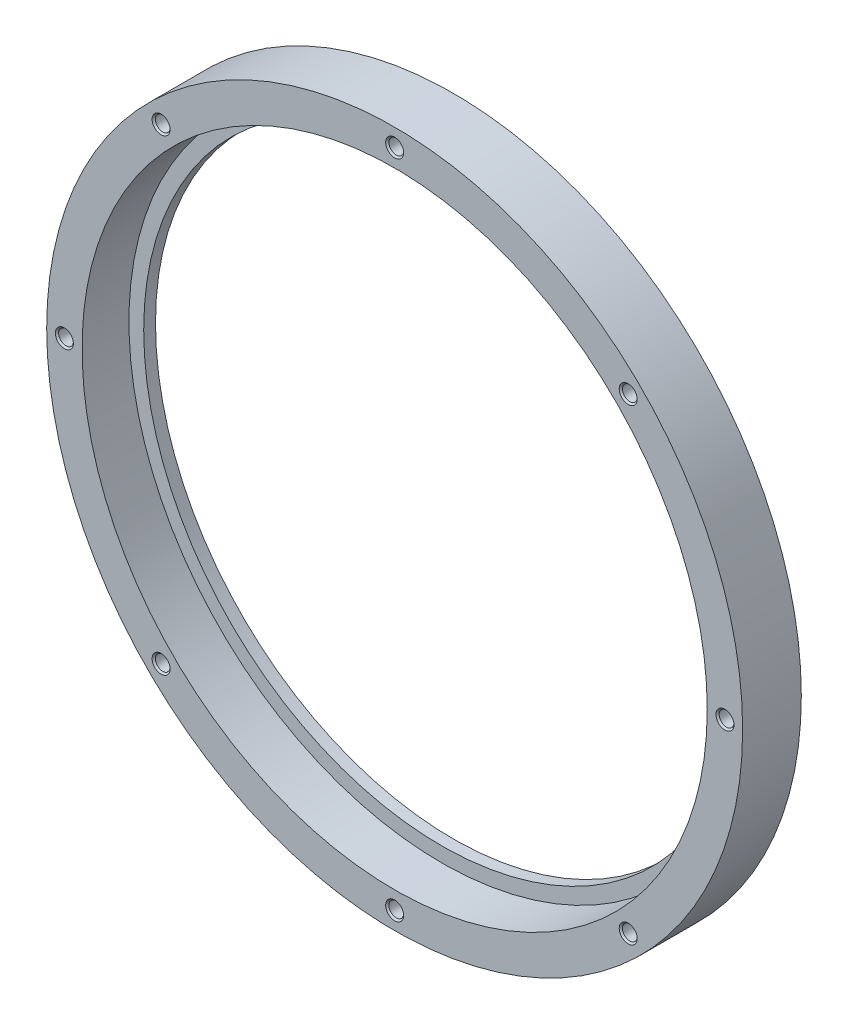
from build123d import *

# Parameters (mm, degrees)
SKETCH_1_R                   = 59
SKETCH_1_R_2                 = 53
EXTRUDE_1_DEPTH              = 3.975
SKETCH_2_R                   = 59
SKETCH_2_R_2                 = 50.5
EXTRUDE_2_DEPTH              = 2
HOLE_WIZARD_M3_1_D           = 2.5
HOLE_WIZARD_M3_1_CSINK_D     = 3.05
HOLE_WIZARD_M3_1_CSINK_ANGLE = 90
PATTERN_CIRCULAR_1_COUNT     = 8


with BuildPart() as part:
    # 草图1 → 凸台-拉伸1 (new, symmetric)
    with BuildSketch(Plane.XY):
        Circle(SKETCH_1_R)
        Circle(SKETCH_1_R_2, mode=Mode.SUBTRACT)
    extrude(amount=EXTRUDE_1_DEPTH, both=True)

    # 草图2 → 凸台-拉伸2 (add)
    with BuildSketch(Plane(origin=(0, 0, -3.975), x_dir=(-1, 0, 0), z_dir=(0, 0, -1))):
        Circle(SKETCH_2_R)
        Circle(SKETCH_2_R_2, mode=Mode.SUBTRACT)
    extrude(amount=EXTRUDE_2_DEPTH)

    # M3 螺纹孔1 (through all)
    with Locations(Plane.XY.offset(3.975)):
        with Locations((0, 56)):
            hole_wizard_m3_1 = CounterSinkHole(HOLE_WIZARD_M3_1_D / 2, HOLE_WIZARD_M3_1_CSINK_D / 2, counter_sink_angle=HOLE_WIZARD_M3_1_CSINK_ANGLE)

    # 阵列(圆周)1: M3 螺纹孔1 ×8 about axis
    pattern_circular_1_axis = Axis((0, 0, 0), (0, 0, 1))
    for i in range(1, PATTERN_CIRCULAR_1_COUNT):
        add(hole_wizard_m3_1.rotate(pattern_circular_1_axis, i * 360 / PATTERN_CIRCULAR_1_COUNT), mode=Mode.SUBTRACT)


solid = part.part
